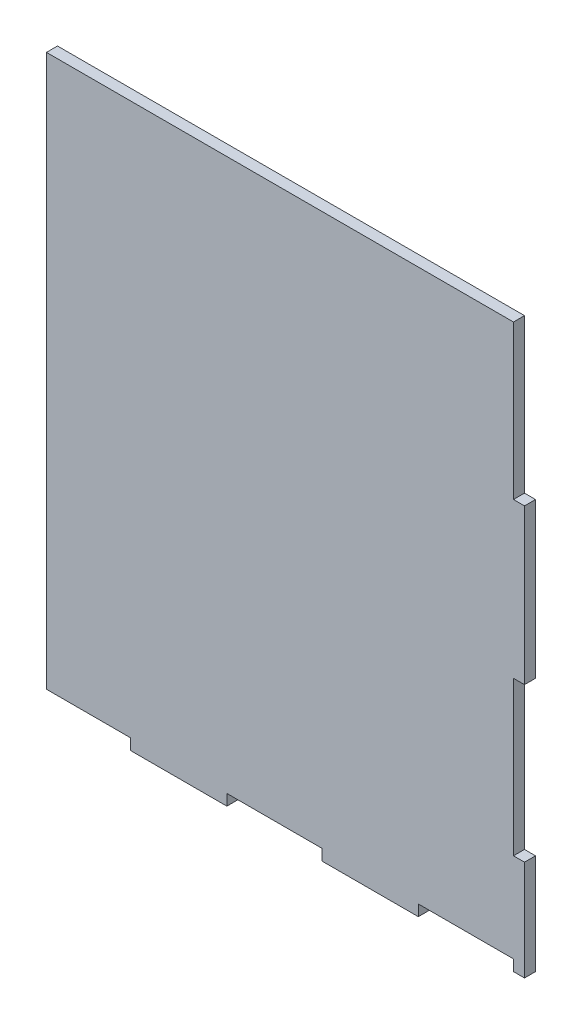
from build123d import *

# Parameters (mm, degrees)
BOSS_EXTRUDE1_DEPTH = 3


with BuildPart() as part:
    # Sketch1 → Boss-Extrude1 (new body)
    with BuildSketch(Plane.XY):
        Polygon((65.741444867, -77.144486692), (68.741444867, -77.144486692), (68.741444867, -49.865915272), (65.741444867, -49.865915272), (65.741444867, -8.058772412), (68.741444867, -8.058772412), (68.741444867, 34.048370448), (65.741444867, 34.048370448), (65.741444867, 75.855513308), (-61.258555133, 75.855513308), (-61.258555133, -74.144486692), (-38.378555133, -74.144486692), (-38.378555133, -77.144486692), (-12.198555133, -77.144486692), (-12.198555133, -74.144486692), (13.681444867, -74.144486692), (13.681444867, -77.144486692), (39.861444867, -77.144486692), (39.861444867, -74.144486692), (65.741444867, -74.144486692), align=None)
    extrude(amount=BOSS_EXTRUDE1_DEPTH)


solid = part.part
